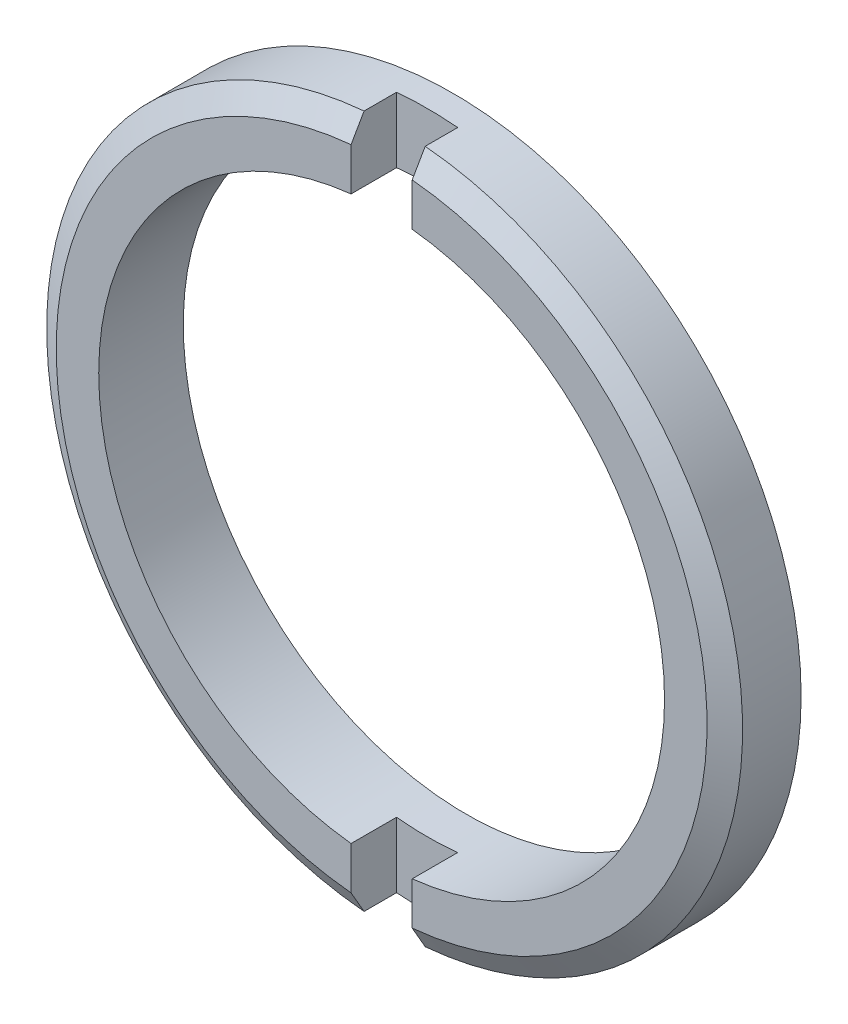
from build123d import *

# Parameters (mm, degrees)
SKETCH1_R          = 6.7945
SKETCH1_R_2        = 5.5245
EXTRUDE1_DEPTH     = 0.8255
CUT_EXTRUDE1_DEPTH = 0.889
CHAMFER1_SIZE      = 0.254
CHAMFER1_SIZE2     = 0.439940905


with BuildPart() as part:
    # Sketch1 → Extrude1 (new, symmetric)
    with BuildSketch(Plane.XY):
        with Locations(Location((0, 0, 0), (0, 0, 180))):
            Circle(SKETCH1_R)
        with Locations(Location((0, 0, 0), (0, 0, 180))):
            Circle(SKETCH1_R_2, mode=Mode.SUBTRACT)
    extrude(amount=EXTRUDE1_DEPTH, both=True)

    # Sketch2 → Cut-Extrude1 (cut)
    with BuildSketch(Plane.XY.offset(0.8255)):
        with BuildLine():
            Line((-0.5969, 6.768230244), (-0.5969, 5.492159014))
            ThreePointArc((-0.5969, 5.492159014), (0, 5.5245), (0.5969, 5.492159014))
            Line((0.5969, 5.492159014), (0.5969, 6.768230244))
            ThreePointArc((0.5969, 6.768230244), (0, 6.7945), (-0.5969, 6.768230244))
        make_face()
        with BuildLine():
            Line((-0.5969, -6.768230244), (-0.5969, -5.492159014))
            ThreePointArc((-0.5969, -5.492159014), (0, -5.5245), (0.5969, -5.492159014))
            Line((0.5969, -5.492159014), (0.5969, -6.768230244))
            ThreePointArc((0.5969, -6.768230244), (0, -6.7945), (-0.5969, -6.768230244))
        make_face()
    extrude(amount=-CUT_EXTRUDE1_DEPTH, mode=Mode.SUBTRACT)

    # Chamfer1
    chamfer1_edges = [part.edges().sort_by_distance(p)[0] for p in [
        (-5.011031196, -4.588550599, 0.8255),
        (6.7945, 0, -0.8255),
        (6.7945, 0, 0.8255),
    ]]
    chamfer1_side = [part.faces().sort_by_distance(p)[0] for p in [
        (6.7945, 0, 0),
    ]]
    chamfer(chamfer1_edges, length=CHAMFER1_SIZE, length2=CHAMFER1_SIZE2, reference=chamfer1_side[0])


solid = part.part
